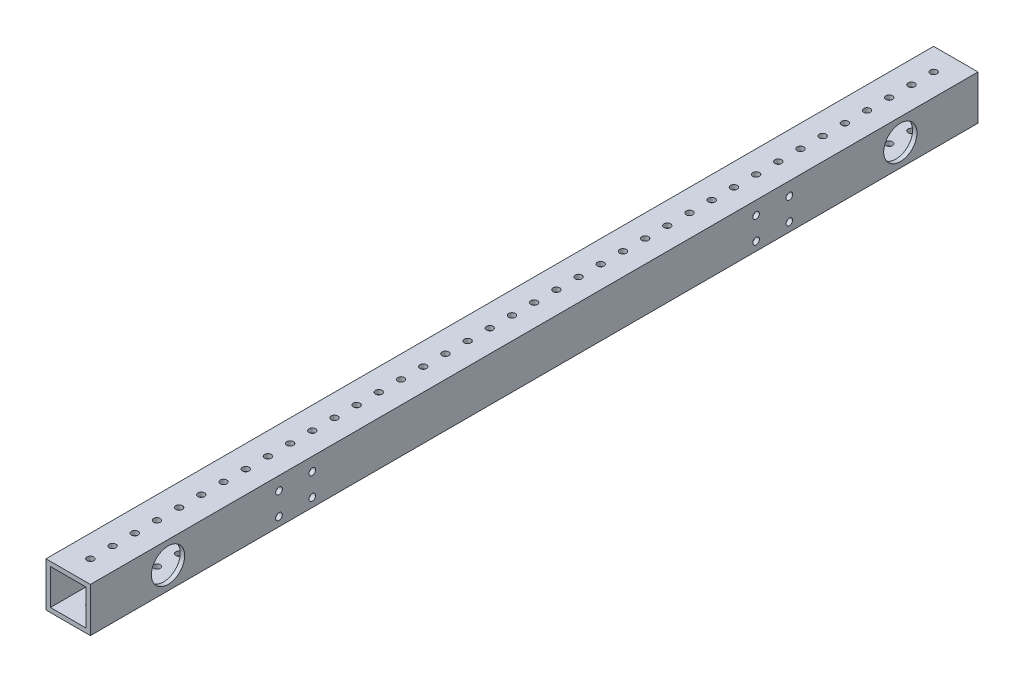
from build123d import *

# Parameters (mm, degrees)
SKETCH_1_W          = 20
SKETCH_1_H          = 20
SKETCH_1_W_2        = 16
SKETCH_1_H_2        = 16
EXTRUDE_1_DEPTH     = 400
SKETCH_9_R          = 1.5
CUT_EXTRUDE_6_DEPTH = 401.998753115
SKETCH_10_R         = 7.5
CUT_EXTRUDE_7_DEPTH = 401.998753115
SKETCH_11_R         = 1.5
CUT_EXTRUDE_8_DEPTH = 401.998753115


with BuildPart() as part:
    # 草图1 → 凸台-拉伸1 (new body)
    with BuildSketch(Plane.XY):
        with Locations((10, 10)):
            Rectangle(SKETCH_1_W, SKETCH_1_H)
        with Locations((10, 10)):
            Rectangle(SKETCH_1_W_2, SKETCH_1_H_2, mode=Mode.SUBTRACT)
    extrude(amount=EXTRUDE_1_DEPTH)

    # 草图9 → 切除-拉伸6 (cut, through all)
    with BuildSketch(Plane(origin=(0, 20, 0), x_dir=(1, 0, 0), z_dir=(0, 1, 0))):
        with Locations(Location((10, -390, 0), (0, 0, 270))):
            Circle(SKETCH_9_R)
        with Locations(Location((10, -380, 0), (0, 0, 270))):
            Circle(SKETCH_9_R)
        with Locations(Location((10, -370, 0), (0, 0, 270))):
            Circle(SKETCH_9_R)
        with Locations(Location((10, -360, 0), (0, 0, 270))):
            Circle(SKETCH_9_R)
        with Locations(Location((10, -350, 0), (0, 0, 270))):
            Circle(SKETCH_9_R)
        with Locations(Location((10, -340, 0), (0, 0, 270))):
            Circle(SKETCH_9_R)
        with Locations(Location((10, -330, 0), (0, 0, 270))):
            Circle(SKETCH_9_R)
        with Locations(Location((10, -320, 0), (0, 0, 270))):
            Circle(SKETCH_9_R)
        with Locations(Location((10, -310, 0), (0, 0, 270))):
            Circle(SKETCH_9_R)
        with Locations(Location((10, -300, 0), (0, 0, 270))):
            Circle(SKETCH_9_R)
        with Locations(Location((10, -290, 0), (0, 0, 270))):
            Circle(SKETCH_9_R)
        with Locations(Location((10, -280, 0), (0, 0, 270))):
            Circle(SKETCH_9_R)
        with Locations(Location((10, -270, 0), (0, 0, 270))):
            Circle(SKETCH_9_R)
        with Locations(Location((10, -260, 0), (0, 0, 270))):
            Circle(SKETCH_9_R)
        with Locations(Location((10, -250, 0), (0, 0, 270))):
            Circle(SKETCH_9_R)
        with Locations(Location((10, -240, 0), (0, 0, 270))):
            Circle(SKETCH_9_R)
        with Locations(Location((10, -230, 0), (0, 0, 270))):
            Circle(SKETCH_9_R)
        with Locations(Location((10, -220, 0), (0, 0, 270))):
            Circle(SKETCH_9_R)
        with Locations(Location((10, -210, 0), (0, 0, 270))):
            Circle(SKETCH_9_R)
        with Locations(Location((10, -200, 0), (0, 0, 270))):
            Circle(SKETCH_9_R)
        with Locations(Location((10, -190, 0), (0, 0, 270))):
            Circle(SKETCH_9_R)
        with Locations(Location((10, -180, 0), (0, 0, 270))):
            Circle(SKETCH_9_R)
        with Locations(Location((10, -170, 0), (0, 0, 270))):
            Circle(SKETCH_9_R)
        with Locations(Location((10, -160, 0), (0, 0, 270))):
            Circle(SKETCH_9_R)
        with Locations(Location((10, -150, 0), (0, 0, 270))):
            Circle(SKETCH_9_R)
        with Locations(Location((10, -140, 0), (0, 0, 270))):
            Circle(SKETCH_9_R)
        with Locations(Location((10, -130, 0), (0, 0, 270))):
            Circle(SKETCH_9_R)
        with Locations(Location((10, -120, 0), (0, 0, 270))):
            Circle(SKETCH_9_R)
        with Locations(Location((10, -110, 0), (0, 0, 270))):
            Circle(SKETCH_9_R)
        with Locations(Location((10, -100, 0), (0, 0, 270))):
            Circle(SKETCH_9_R)
        with Locations(Location((10, -90, 0), (0, 0, 270))):
            Circle(SKETCH_9_R)
        with Locations(Location((10, -80, 0), (0, 0, 270))):
            Circle(SKETCH_9_R)
        with Locations(Location((10, -70, 0), (0, 0, 270))):
            Circle(SKETCH_9_R)
        with Locations(Location((10, -60, 0), (0, 0, 270))):
            Circle(SKETCH_9_R)
        with Locations(Location((10, -50, 0), (0, 0, 270))):
            Circle(SKETCH_9_R)
        with Locations(Location((10, -40, 0), (0, 0, 270))):
            Circle(SKETCH_9_R)
        with Locations(Location((10, -30, 0), (0, 0, 270))):
            Circle(SKETCH_9_R)
        with Locations(Location((10, -20, 0), (0, 0, 270))):
            Circle(SKETCH_9_R)
        with Locations(Location((10, -10, 0), (0, 0, 270))):
            Circle(SKETCH_9_R)
    extrude(amount=-CUT_EXTRUDE_6_DEPTH, mode=Mode.SUBTRACT)

    # 草图10 → 切除-拉伸7 (cut, through all)
    with BuildSketch(Plane(origin=(20, 0, 0), x_dir=(0, 0, -1), z_dir=(1, 0, 0))):
        with Locations((-365, 10)):
            Circle(SKETCH_10_R)
        with Locations((-35, 10)):
            Circle(SKETCH_10_R)
    extrude(amount=-CUT_EXTRUDE_7_DEPTH, mode=Mode.SUBTRACT)

    # 草图11 → 切除-拉伸8 (cut, through all)
    with BuildSketch(Plane(origin=(20, 0, 0), x_dir=(0, 0, -1), z_dir=(1, 0, 0))):
        with Locations((-315, 14)):
            Circle(SKETCH_11_R)
        with Locations((-300, 14)):
            Circle(SKETCH_11_R)
        with Locations((-300, 4)):
            Circle(SKETCH_11_R)
        with Locations((-315, 4)):
            Circle(SKETCH_11_R)
        with Locations(Location((-85, 4, 0), (0, 0, 180))):
            Circle(SKETCH_11_R)
        with Locations(Location((-100, 4, 0), (0, 0, 180))):
            Circle(SKETCH_11_R)
        with Locations(Location((-100, 14, 0), (0, 0, 180))):
            Circle(SKETCH_11_R)
        with Locations(Location((-85, 14, 0), (0, 0, 180))):
            Circle(SKETCH_11_R)
    extrude(amount=-CUT_EXTRUDE_8_DEPTH, mode=Mode.SUBTRACT)


solid = part.part
